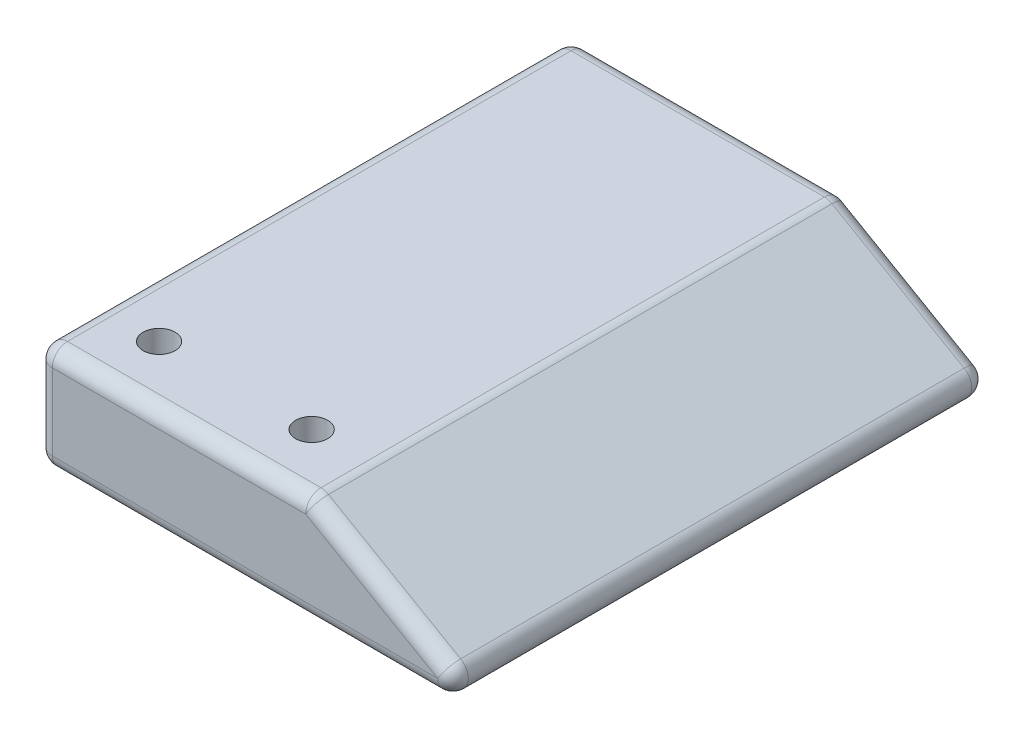
from build123d import *

# Parameters (mm, degrees)
BOSS_EXTRUDE1_DEPTH   = 70
FILLET1_R             = 2
M5_TAPPED_HOLE1_D     = 4.2
M5_TAPPED_HOLE1_DEPTH = 12.5
M5_TAPPED_HOLE1_TIP   = 1.2618073


with BuildPart() as part:
    # Sketch1 → Boss-Extrude1 (new body)
    with BuildSketch(Plane.XY):
        Polygon((0, 0), (0, 14), (35.751288694, 14), (60, 0), align=None)
    extrude(amount=BOSS_EXTRUDE1_DEPTH)

    # Fillet1
    fillet1_edges = [part.edges().sort_by_distance(p)[0] for p in [
        (17.875644347, 14, 70),
        (0, 7, 70),
        (30, 0, 70),
        (0, 7, 0),
        (17.875644347, 14, 0),
        (47.875644347, 7, 0),
        (30, 0, 0),
        (0, 0, 35),
        (0, 14, 35),
        (35.751288694, 14, 35),
        (60, 0, 35),
        (47.875644347, 7, 70),
    ]]
    fillet(fillet1_edges, radius=FILLET1_R)

    # M5 Tapped Hole1
    with Locations(Plane(origin=(0, 14, 0), x_dir=(1, 0, 0), z_dir=(0, 1, 0))):
        with Locations((8, -62), (28, -62)):
            Hole(M5_TAPPED_HOLE1_D / 2, depth=M5_TAPPED_HOLE1_DEPTH)
            with Locations((0, 0, -(M5_TAPPED_HOLE1_DEPTH + M5_TAPPED_HOLE1_TIP / 2))):  # 118° drill point
                Cone(0, M5_TAPPED_HOLE1_D / 2, M5_TAPPED_HOLE1_TIP, mode=Mode.SUBTRACT)


solid = part.part
